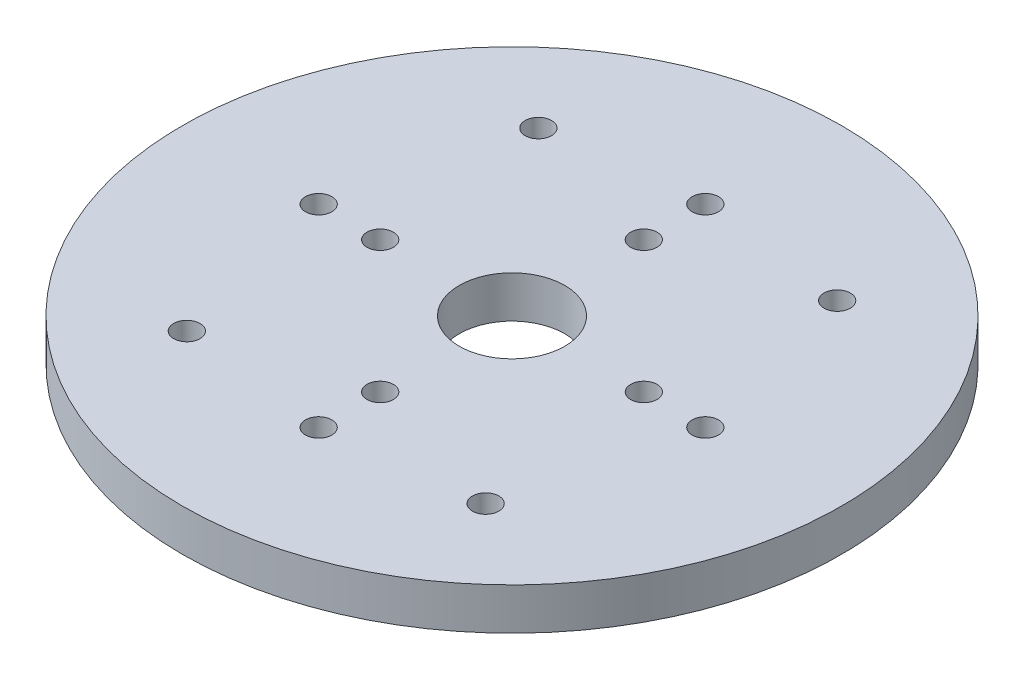
from build123d import *

# Parameters (mm, degrees)
SKETCH1_R                 = 37.5
SKETCH1_R_2               = 6
BOSS_EXTRUDE1_DEPTH       = 4.7625
F_3_0MM_DOWEL_HOLE1_D     = 3
F_3_0MM_DOWEL_HOLE4_D     = 3
F_3_0MM_DOWEL_HOLE4_DEPTH = 10
F_3_0MM_DOWEL_HOLE4_TIP   = 0.901290929


with BuildPart() as part:
    # Sketch1 → Boss-Extrude1 (new body)
    with BuildSketch(Plane(origin=(0, 0, 0), x_dir=(1, 0, 0), z_dir=(0, 1, 0))):
        with Locations(Location((0, 0, 0), (0, 0, 90))):
            Circle(SKETCH1_R)
        with Locations(Location((0, 0, 0), (0, 0, 90))):
            Circle(SKETCH1_R_2, mode=Mode.SUBTRACT)
    extrude(amount=BOSS_EXTRUDE1_DEPTH)

    # Ø3.0mm Dowel Hole1 (through all)
    with Locations(Plane(origin=(0, 0, 0), x_dir=(-1, 0, 0), z_dir=(0, -1, 0))):
        with Locations((0, 15), (0, 22), (22, 0), (15, 0), (0, -15), (0, -22), (-15, 0), (-22, 0)):
            Hole(F_3_0MM_DOWEL_HOLE1_D / 2)

    # Ø3.0mm Dowel Hole4
    with Locations(Plane(origin=(0, 4.7625, 0), x_dir=(1, 0, 0), z_dir=(0, 1, 0))):
        with Locations((-17, 20), (17, -20), (-17, -20), (17, 20)):
            Hole(F_3_0MM_DOWEL_HOLE4_D / 2, depth=F_3_0MM_DOWEL_HOLE4_DEPTH)
            with Locations((0, 0, -(F_3_0MM_DOWEL_HOLE4_DEPTH + F_3_0MM_DOWEL_HOLE4_TIP / 2))):  # 118° drill point
                Cone(0, F_3_0MM_DOWEL_HOLE4_D / 2, F_3_0MM_DOWEL_HOLE4_TIP, mode=Mode.SUBTRACT)


solid = part.part
